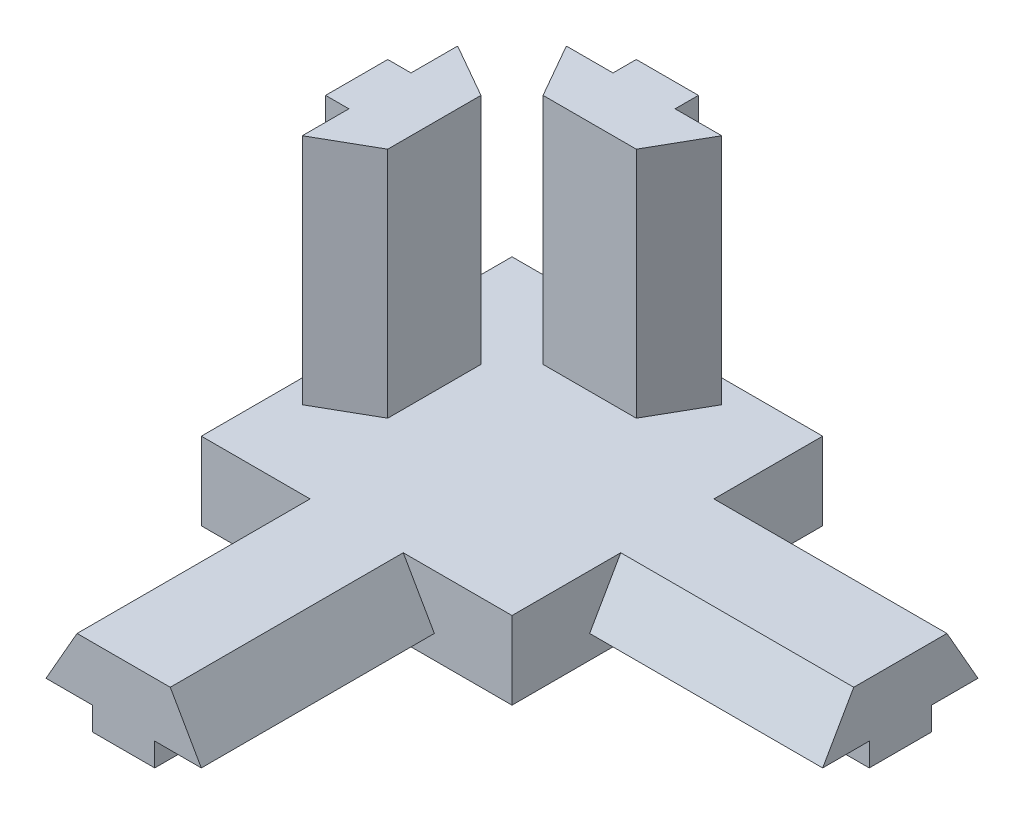
from build123d import *

# Parameters (mm, degrees)
SKETCH1_W           = 20
SKETCH1_H           = 20
BOSS_EXTRUDE1_DEPTH = 2.5
BOSS_EXTRUDE2_DEPTH = 15
CIRPATTERN1_COUNT   = 2
CIRPATTERN1_ANGLE   = 90
BOSS_EXTRUDE3_DEPTH = 15
CIRPATTERN2_COUNT   = 2
CIRPATTERN2_ANGLE   = 90


with BuildPart() as part:
    # Sketch1 → Boss-Extrude1 (new, symmetric)
    with BuildSketch(Plane(origin=(0, 0, 0), x_dir=(1, 0, 0), z_dir=(0, 1, 0))):
        Rectangle(SKETCH1_W, SKETCH1_H)
    extrude(amount=BOSS_EXTRUDE1_DEPTH, both=True)

    # Sketch2 → Boss-Extrude2 (add)
    with BuildSketch(Plane(origin=(0, 2.5, 0), x_dir=(1, 0, 0), z_dir=(0, 1, 0))):
        Polygon((-2, 10), (2, 10), (2, 8.5), (5, 8.5), (3, 5), (-3, 5), (-5, 8.5), (-2, 8.5), align=None)
    boss_extrude2 = extrude(amount=BOSS_EXTRUDE2_DEPTH)

    # CirPattern1: Boss-Extrude2 ×2 about axis
    cirpattern1_axis = Axis((0, 0, 0), (0, 1, 0))
    for i in range(1, CIRPATTERN1_COUNT):
        add(boss_extrude2.rotate(cirpattern1_axis, i * CIRPATTERN1_ANGLE / (CIRPATTERN1_COUNT - 1)))

    # Sketch3 → Boss-Extrude3 (add)
    with BuildSketch(Plane(origin=(10, 0, 0), x_dir=(0, 0, -1), z_dir=(1, 0, 0))):
        Polygon((-3, 2.5), (3, 2.5), (5, -1), (2, -1), (2, -2.5), (-2, -2.5), (-2, -1), (-5, -1), align=None)
    boss_extrude3 = extrude(amount=BOSS_EXTRUDE3_DEPTH)

    # CirPattern2: Boss-Extrude3 ×2 about axis
    cirpattern2_axis = Axis((0, 0, 0), (0, -1, 0))
    for i in range(1, CIRPATTERN2_COUNT):
        add(boss_extrude3.rotate(cirpattern2_axis, i * CIRPATTERN2_ANGLE / (CIRPATTERN2_COUNT - 1)))


solid = part.part
